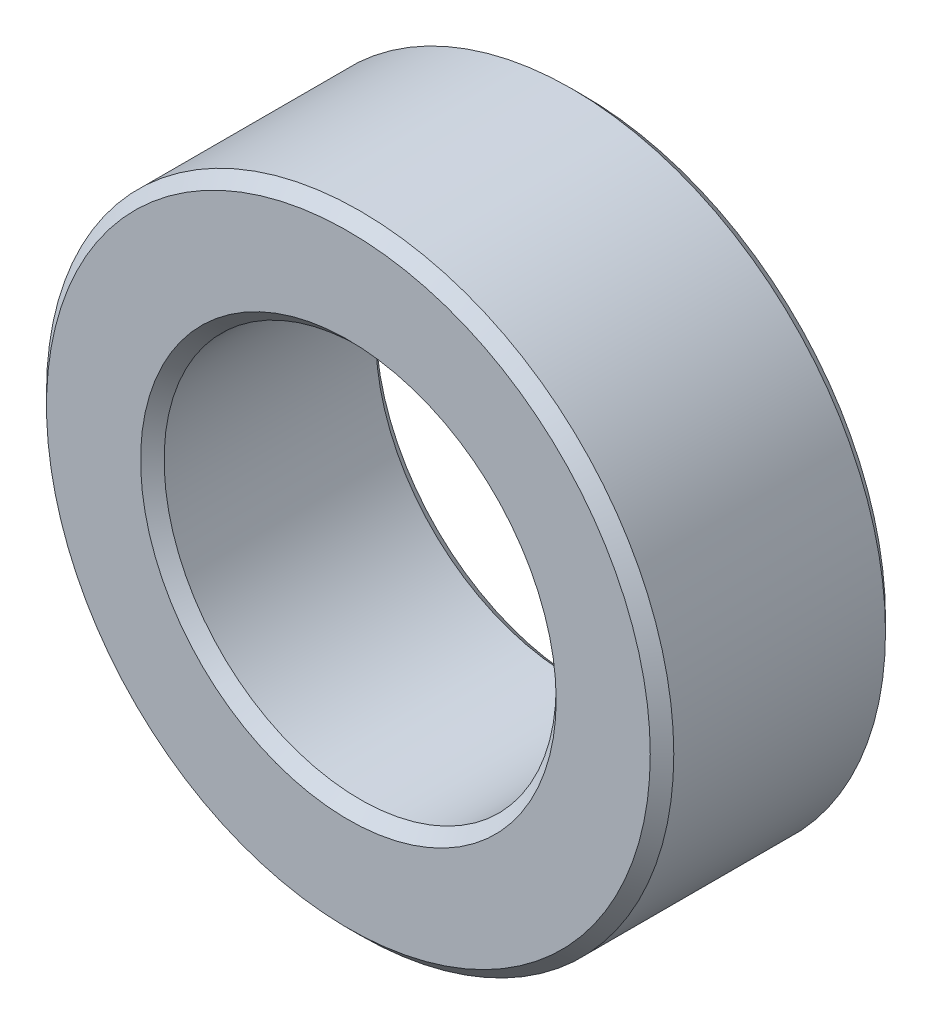
from build123d import *

# Parameters (mm, degrees)
BOSS_EXTRUDE1_DEPTH      = 4.7625
BOSS_EXTRUDE1_DEPTH_BACK = 4.7625
SKETCH3_R                = 12.7
SKETCH3_R_2              = 7.9375
CHAMFER1_SIZE            = 0.47625


with BuildPart() as part:
    # Sketch3 → Boss-Extrude1 (new, two sides: drawn at the far end of the back side and taken through both)
    with BuildSketch(Plane.XY.offset(-BOSS_EXTRUDE1_DEPTH_BACK)):
        Circle(SKETCH3_R)
        Circle(SKETCH3_R_2, mode=Mode.SUBTRACT)
    extrude(amount=BOSS_EXTRUDE1_DEPTH + BOSS_EXTRUDE1_DEPTH_BACK)

    # Chamfer1
    chamfer1_edges = [part.edges().sort_by_distance(p)[0] for p in [
        (-12.7, 0, -4.7625),
        (-7.9375, 0, -4.7625),
        (-12.7, 0, 4.7625),
        (-7.9375, 0, 4.7625),
    ]]
    chamfer(chamfer1_edges, length=CHAMFER1_SIZE)


solid = part.part
